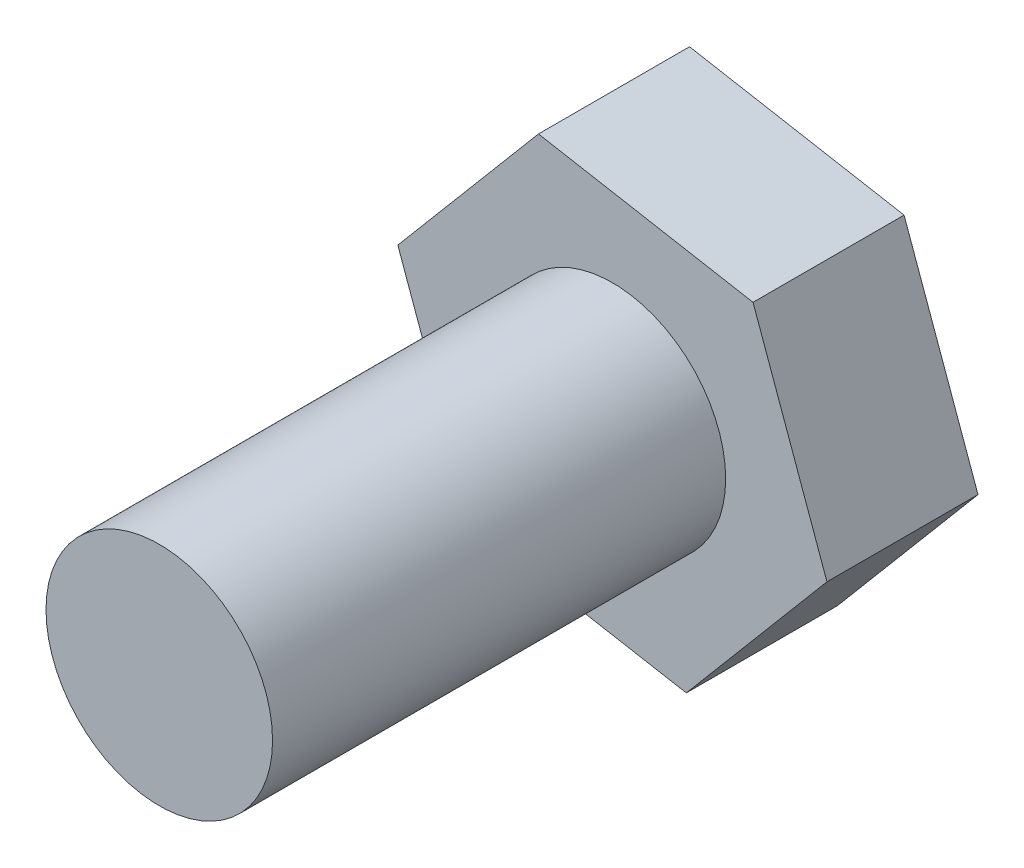
from build123d import *

# Parameters (mm, degrees)
EXTRUDE_1_DEPTH = 4
SKETCH_2_R      = 3
EXTRUDE_2_DEPTH = 12


with BuildPart() as part:
    # ｽｹｯﾁ1 → ﾎﾞｽ - 押し出し1 (new body)
    with BuildSketch(Plane.XY):
        Polygon((-3.724743834, -4.411305556), (1.957930758, -5.431375561), (5.682674592, -1.020070005), (3.724743834, 4.411305556), (-1.957930758, 5.431375561), (-5.682674592, 1.020070005), align=None)
    extrude(amount=EXTRUDE_1_DEPTH)

    # ｽｹｯﾁ2 → ﾎﾞｽ - 押し出し2 (add)
    with BuildSketch(Plane.XY.offset(4)):
        Circle(SKETCH_2_R)
    extrude(amount=EXTRUDE_2_DEPTH)


solid = part.part
